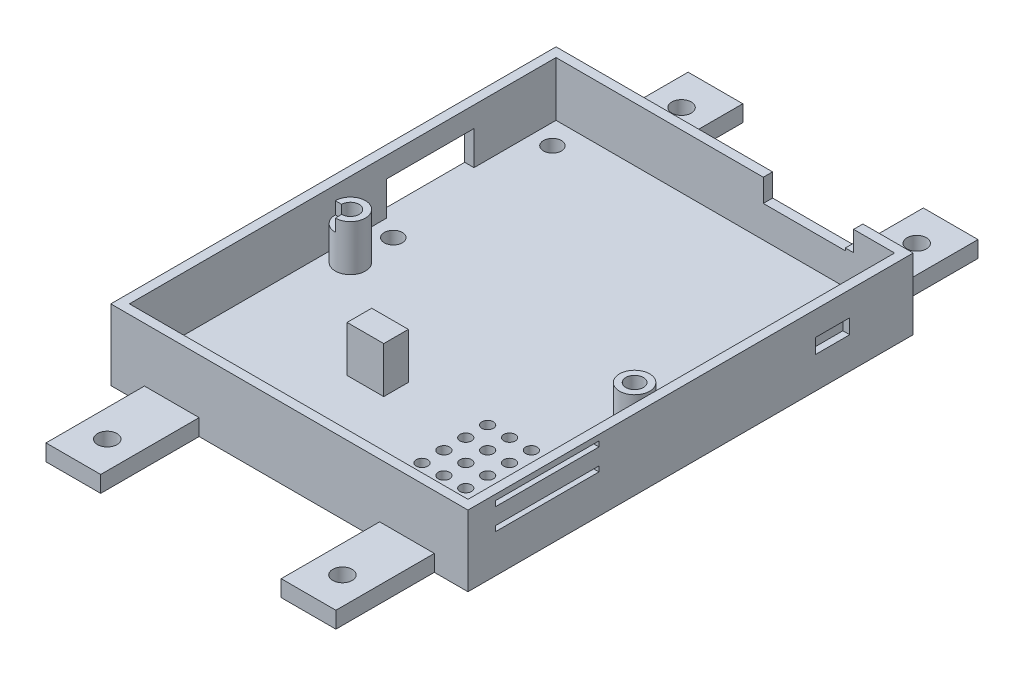
from build123d import *

# Parameters (mm, degrees)
BOSS_EXTRUDE1_DEPTH      = 3
SKETCH3_W                = 65.3
SKETCH3_H                = 81.4
SKETCH3_W_2              = 61.9
SKETCH3_H_2              = 78
BOSS_EXTRUDE2_DEPTH      = 9.94
SKETCH4_R                = 1.65
SKETCH4_R_2              = 1.6
SKETCH4_W                = 6.7
SKETCH4_H                = 4.5
CUT_EXTRUDE1_DEPTH       = 105.10221696
BOSS_EXTRUDE3_DEPTH      = 10.15
BOSS_EXTRUDE3_DEPTH_BACK = 3
SKETCH5_W                = 6.7
SKETCH5_H                = 4.5
SKETCH6_R                = 2.75
BOSS_EXTRUDE4_DEPTH      = 10.15
BOSS_EXTRUDE4_2_DEPTH    = 10.15
CUT_EXTRUDE2_DEPTH       = 4
SKETCH17_R               = 1.6
CUT_EXTRUDE11_DEPTH      = 105.457601332
SKETCH19_W               = 16
SKETCH19_H               = 6.2
CUT_EXTRUDE12_DEPTH      = 112.285255161
SKETCH20_W               = 15
SKETCH20_H               = 4.15
CUT_EXTRUDE13_DEPTH      = 111.86097131
SKETCH21_R               = 2.75
CUT_EXTRUDE14_DEPTH      = 1.75
SKETCH22_R               = 2.75
CUT_EXTRUDE15_DEPTH      = 1.75
SKETCH23_W               = 6.7
SKETCH23_H               = 4.5
CUT_EXTRUDE16_DEPTH      = 1.75
SKETCH10_R               = 1.05
CUT_EXTRUDE5_DEPTH       = 105.10221696
SKETCH11_W               = 6.3
SKETCH11_H               = 2.7
CUT_EXTRUDE6_DEPTH       = 1.25
SKETCH15_W               = 16.1
SKETCH15_H               = 3.7
CUT_EXTRUDE9_DEPTH       = 111.836257876
SKETCH16_W               = 18.956236151
SKETCH16_H               = 0.955067826
CUT_EXTRUDE10_DEPTH      = 1.7
SKETCH24_R               = 1.775
CUT_EXTRUDE17_DEPTH      = 105.10221696


with BuildPart() as part:
    # Sketch2 → Boss-Extrude1 (new body)
    with BuildSketch(Plane(origin=(0, 0, 0), x_dir=(1, 0, 0), z_dir=(0, 1, 0))):
        Polygon((-34.564322039, -72.368830446), (-1.564322039, -72.368830446), (-1.564322039, -90.368830446), (8.435677961, -90.368830446), (8.435677961, -72.368830446), (14.585677961, -72.368830446), (14.585677961, 9.031169554), (8.435677961, 9.031169554), (8.435677961, 27.031169554), (-1.564322039, 27.031169554), (-1.564322039, 9.031169554), (-34.564322039, 9.031169554), (-34.564322039, 27.031169554), (-44.564322039, 27.031169554), (-44.564322039, 9.031169554), (-50.714322039, 9.031169554), (-50.714322039, -72.368830446), (-44.564322039, -72.368830446), (-44.564322039, -90.368830446), (-34.564322039, -90.368830446), align=None)
    extrude(amount=BOSS_EXTRUDE1_DEPTH)

    # Sketch3 → Boss-Extrude2 (add)
    with BuildSketch(Plane(origin=(0, 3, 0), x_dir=(1, 0, 0), z_dir=(0, 1, 0))):
        with Locations((-18.064322039, -31.668830446)):
            Rectangle(SKETCH3_W, SKETCH3_H)
        with Locations((-18.064322039, -31.668830446)):
            Rectangle(SKETCH3_W_2, SKETCH3_H_2, mode=Mode.SUBTRACT)
    extrude(amount=BOSS_EXTRUDE2_DEPTH)

    # Sketch4 → Cut-Extrude1 (cut, through all)
    with BuildSketch(Plane(origin=(0, 3, 0), x_dir=(1, 0, 0), z_dir=(0, 1, 0))):
        with Locations(Location((-45.314322039, 2.981169554, 0), (0, 0, 270))):
            Circle(SKETCH4_R)
        with Locations(Location((-45.314322039, -26.118830446, 0), (0, 0, 270))):
            Circle(SKETCH4_R)
        with Locations(Location((7.885677961, 2.981169554, 0), (0, 0, 270))):
            Circle(SKETCH4_R)
        with Locations(Location((7.885677961, -26.118830446, 0), (0, 0, 270))):
            Circle(SKETCH4_R)
        with Locations(Location((-45.314322039, -33.968830446, 0), (0, 0, 270))):
            Circle(SKETCH4_R_2)
        with Locations(Location((8.080008321, -35.398830446, 0), (0, 0, 270))):
            Circle(SKETCH4_R_2)
        with Locations((-24.364322039, -49.918830446)):
            Rectangle(SKETCH4_W, SKETCH4_H)
    extrude(amount=-CUT_EXTRUDE1_DEPTH, mode=Mode.SUBTRACT)

    # Sketch19 → Cut-Extrude12 (cut, through all)
    with BuildSketch(Plane(origin=(-49.014322039, 0, 0), x_dir=(0, 0, -1), z_dir=(1, 0, 0))):
        with Locations((-15.668830446, 6.1)):
            Rectangle(SKETCH19_W, SKETCH19_H)
    extrude(amount=-CUT_EXTRUDE12_DEPTH, mode=Mode.SUBTRACT)

    # Sketch20 → Cut-Extrude13 (cut, through all)
    with BuildSketch(Plane.XY.offset(-7.331169554)):
        with Locations((-3.614322039, 10.865)):
            Rectangle(SKETCH20_W, SKETCH20_H)
    extrude(amount=-CUT_EXTRUDE13_DEPTH, mode=Mode.SUBTRACT)

    # Sketch10 → Cut-Extrude5 (cut, through all)
    with BuildSketch(Plane(origin=(0, 3, 0), x_dir=(1, 0, 0), z_dir=(0, 1, 0))):
        with Locations(Location((-7.016588034, -47.168830446, 0), (0, 0, 270))):
            Circle(SKETCH10_R)
        with Locations(Location((-3.016588034, -47.168830446, 0), (0, 0, 270))):
            Circle(SKETCH10_R)
        with Locations(Location((0.983411966, -47.168830446, 0), (0, 0, 270))):
            Circle(SKETCH10_R)
        with Locations(Location((4.983411966, -47.168830446, 0), (0, 0, 270))):
            Circle(SKETCH10_R)
        with Locations(Location((8.983411966, -47.168830446, 0), (0, 0, 270))):
            Circle(SKETCH10_R)
        with Locations(Location((-3.016588034, -51.168830446, 0), (0, 0, 270))):
            Circle(SKETCH10_R)
        with Locations(Location((0.983411966, -51.168830446, 0), (0, 0, 270))):
            Circle(SKETCH10_R)
        with Locations(Location((4.983411966, -51.168830446, 0), (0, 0, 270))):
            Circle(SKETCH10_R)
        with Locations(Location((8.983411966, -51.168830446, 0), (0, 0, 270))):
            Circle(SKETCH10_R)
        with Locations(Location((-3.016588034, -55.168830446, 0), (0, 0, 270))):
            Circle(SKETCH10_R)
        with Locations(Location((0.983411966, -55.168830446, 0), (0, 0, 270))):
            Circle(SKETCH10_R)
        with Locations(Location((4.983411966, -55.168830446, 0), (0, 0, 270))):
            Circle(SKETCH10_R)
        with Locations(Location((8.983411966, -55.168830446, 0), (0, 0, 270))):
            Circle(SKETCH10_R)
        with Locations(Location((-3.016588034, -59.168830446, 0), (0, 0, 270))):
            Circle(SKETCH10_R)
        with Locations(Location((0.983411966, -59.168830446, 0), (0, 0, 270))):
            Circle(SKETCH10_R)
        with Locations(Location((4.983411966, -59.168830446, 0), (0, 0, 270))):
            Circle(SKETCH10_R)
        with Locations(Location((8.983411966, -59.168830446, 0), (0, 0, 270))):
            Circle(SKETCH10_R)
        with Locations(Location((-7.016588034, -51.168830446, 0), (0, 0, 270))):
            Circle(SKETCH10_R)
        with Locations(Location((-7.016588034, -55.168830446, 0), (0, 0, 270))):
            Circle(SKETCH10_R)
        with Locations(Location((-7.016588034, -59.168830446, 0), (0, 0, 270))):
            Circle(SKETCH10_R)
    extrude(amount=-CUT_EXTRUDE5_DEPTH, mode=Mode.SUBTRACT)

    # Sketch11 → Cut-Extrude6 (cut)
    with BuildSketch(Plane(origin=(14.585677961, 0, 0), x_dir=(0, 0, -1), z_dir=(1, 0, 0))):
        with Locations((-5.718830446, 7.15)):
            Rectangle(SKETCH11_W, SKETCH11_H)
    extrude(amount=-CUT_EXTRUDE6_DEPTH, mode=Mode.SUBTRACT)

    # Sketch15 → Cut-Extrude9 (cut, through all)
    with BuildSketch(Plane.XY.offset(-7.331169554)):
        with Locations((-2.664322039, 11.09)):
            Rectangle(SKETCH15_W, SKETCH15_H)
    extrude(amount=-CUT_EXTRUDE9_DEPTH, mode=Mode.SUBTRACT)

    # Sketch16 → Cut-Extrude10 (cut)
    with BuildSketch(Plane(origin=(14.585677961, 0, 0), x_dir=(0, 0, -1), z_dir=(1, 0, 0))):
        with Locations((-57.890712371, 11.432601739)):
            Rectangle(SKETCH16_W, SKETCH16_H)
        with Locations((-57.890712371, 7.477533913)):
            Rectangle(SKETCH16_W, SKETCH16_H)
    extrude(amount=-CUT_EXTRUDE10_DEPTH, mode=Mode.SUBTRACT)

    # Sketch24 → Cut-Extrude17 (cut, through all)
    with BuildSketch(Plane(origin=(0, 3, 0), x_dir=(1, 0, 0), z_dir=(0, 1, 0))):
        with Locations(Location((-39.564322039, 20.831169554, 0), (0, 0, 270))):
            Circle(SKETCH24_R)
        with Locations(Location((3.435677961, 20.831169554, 0), (0, 0, 270))):
            Circle(SKETCH24_R)
        with Locations(Location((3.435677961, -84.168830446, 0), (0, 0, 270))):
            Circle(SKETCH24_R)
        with Locations(Location((-39.564322039, -84.168830446, 0), (0, 0, 270))):
            Circle(SKETCH24_R)
    extrude(amount=-CUT_EXTRUDE17_DEPTH, mode=Mode.SUBTRACT)


with BuildPart() as body_2:
    # Sketch5 → Boss-Extrude3 (new, two sides: drawn at the far end of the back side and taken through both)
    with BuildSketch(Plane(origin=(0, 3, 0), x_dir=(1, 0, 0), z_dir=(0, 1, 0)).offset(-BOSS_EXTRUDE3_DEPTH_BACK)):
        with Locations((-24.364322039, -49.918830446)):
            Rectangle(SKETCH5_W, SKETCH5_H)
    extrude(amount=BOSS_EXTRUDE3_DEPTH + BOSS_EXTRUDE3_DEPTH_BACK)

    # Sketch23 → Cut-Extrude16 (cut)
    with BuildSketch(Plane(origin=(0, 13.15, 0), x_dir=(1, 0, 0), z_dir=(0, 1, 0))):
        with Locations((-24.364322039, -49.918830446)):
            Rectangle(SKETCH23_W, SKETCH23_H)
    extrude(amount=-CUT_EXTRUDE16_DEPTH, mode=Mode.SUBTRACT)


with BuildPart() as body_3:
    # Sketch6 → Boss-Extrude4 (new body)
    with BuildSketch(Plane(origin=(0, 3, 0), x_dir=(1, 0, 0), z_dir=(0, 1, 0))):
        with Locations(Location((-45.314322039, -33.968830446, 0), (0, 0, 270))):
            Circle(SKETCH6_R)
    extrude(amount=BOSS_EXTRUDE4_DEPTH)

    # Sketch7 → Cut-Extrude2 (cut)
    with BuildSketch(Plane(origin=(0, 13.15, 0), x_dir=(1, 0, 0), z_dir=(0, 1, 0))):
        with BuildLine():
            Line((-48.064322039, -33.968830446), (-45.314322039, -33.968830446))
            Line((-45.314322039, -33.968830446), (-45.314322039, -36.718830446))
            ThreePointArc((-45.314322039, -36.718830446), (-47.258865687, -35.913374094), (-48.064322039, -33.968830446))
        make_face()
    extrude(amount=-CUT_EXTRUDE2_DEPTH, mode=Mode.SUBTRACT)


with BuildPart() as body_4:
    # Sketch6 → Boss-Extrude4 2 (new body)
    with BuildSketch(Plane(origin=(0, 3, 0), x_dir=(1, 0, 0), z_dir=(0, 1, 0))):
        with Locations(Location((8.080008321, -35.398830446, 0), (0, 0, 270))):
            Circle(SKETCH6_R)
    extrude(amount=BOSS_EXTRUDE4_2_DEPTH)


with BuildPart() as cut_extrude11_tool:
    # Sketch17 → Cut-Extrude11 (new, through all)
    with BuildSketch(Plane(origin=(0, 13.15, 0), x_dir=(1, 0, 0), z_dir=(0, 1, 0))):
        with Locations(Location((-45.314322039, -33.968830446, 0), (0, 0, 270))):
            Circle(SKETCH17_R)
        with Locations(Location((8.080008321, -35.398830446, 0), (0, 0, 270))):
            Circle(SKETCH17_R)
    extrude(amount=-CUT_EXTRUDE11_DEPTH)


with BuildPart() as body_3_1:
    add(body_3.part)

    # Cut-Extrude11: cut by cut_extrude11_tool
    add(cut_extrude11_tool.part, mode=Mode.SUBTRACT)

    # Sketch21 → Cut-Extrude14 (cut)
    with BuildSketch(Plane(origin=(0, 13.15, 0), x_dir=(1, 0, 0), z_dir=(0, 1, 0))):
        with Locations(Location((-45.314322039, -33.968830446, 0), (0, 0, 270))):
            Circle(SKETCH21_R)
    extrude(amount=-CUT_EXTRUDE14_DEPTH, mode=Mode.SUBTRACT)


with BuildPart() as body_4_1:
    add(body_4.part)

    # Cut-Extrude11: cut by cut_extrude11_tool
    add(cut_extrude11_tool.part, mode=Mode.SUBTRACT)

    # Sketch22 → Cut-Extrude15 (cut)
    with BuildSketch(Plane(origin=(0, 13.15, 0), x_dir=(1, 0, 0), z_dir=(0, 1, 0))):
        with Locations(Location((8.080008321, -35.398830446, 0), (0, 0, 270))):
            Circle(SKETCH22_R)
    extrude(amount=-CUT_EXTRUDE15_DEPTH, mode=Mode.SUBTRACT)


solid = Compound([part.part, body_2.part, body_3_1.part, body_4_1.part])
